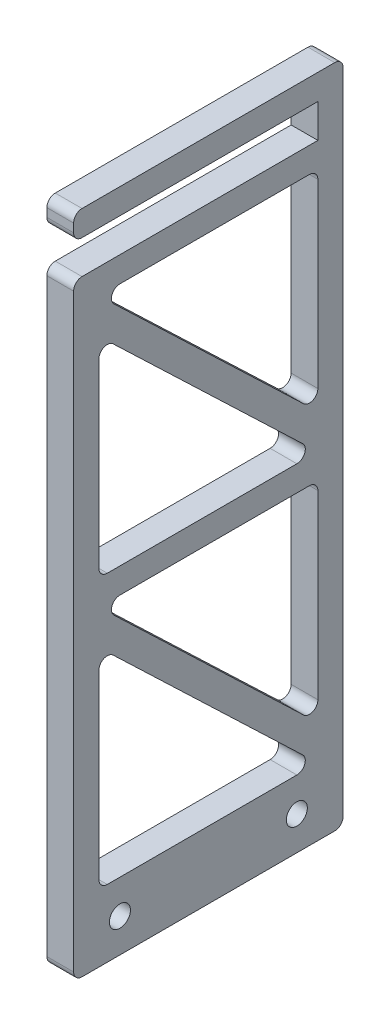
from build123d import *

# Parameters (mm, degrees)
SKETCH1_W             = 32
SKETCH1_H             = 79
BOSS_EXTRUDE1_DEPTH   = 3.175
SKETCH2_W             = 29
SKETCH2_H             = 4
CUT_EXTRUDE1_DEPTH    = 3.175
F_2_5MM_DOWEL_HOLE1_D = 2.5
CUT_EXTRUDE2_DEPTH    = 3.175
FILLET2_R             = 1
FILLET3_R             = 1


with BuildPart() as part:
    # Sketch1 → Boss-Extrude1 (new body)
    with BuildSketch(Plane(origin=(0, 0, 0), x_dir=(0, 0, -1), z_dir=(1, 0, 0))):
        Rectangle(SKETCH1_W, SKETCH1_H)
    extrude(amount=BOSS_EXTRUDE1_DEPTH)

    # Sketch2 → Cut-Extrude1 (cut)
    with BuildSketch(Plane(origin=(3.175, 0, 0), x_dir=(0, 0, -1), z_dir=(1, 0, 0))):
        with Locations((-1.5, 34.5)):
            Rectangle(SKETCH2_W, SKETCH2_H)
    extrude(amount=-CUT_EXTRUDE1_DEPTH, mode=Mode.SUBTRACT)

    # Ø2.5mm Dowel Hole1 (through all)
    with Locations(Plane.ZY):
        with Locations((-10.5, -35.5), (10.5, -35.5)):
            Hole(F_2_5MM_DOWEL_HOLE1_D / 2)

    # Sketch8 → Cut-Extrude2 (cut)
    with BuildSketch(Plane(origin=(3.175, 0, 0), x_dir=(0, 0, -1), z_dir=(1, 0, 0))):
        Polygon((-13, -31.5), (13, -31.5), (-13, -6.649883213), align=None)
        Polygon((-13, -2.5), (13, -27.350116787), (13, -2.5), align=None)
        Polygon((-13, 0.5), (13, 0.5), (-13, 25.350116787), align=None)
        Polygon((-13, 29.5), (13, 4.649883213), (13, 29.5), align=None)
    extrude(amount=-CUT_EXTRUDE2_DEPTH, mode=Mode.SUBTRACT)

    # Fillet2
    fillet2_edges = [part.edges().sort_by_distance(p)[0] for p in [
        (1.5875, 32.5, 16),
        (1.5875, 36.5, 16),
        (1.5875, -39.5, -16),
        (1.5875, -39.5, 16),
        (1.5875, 39.5, 16),
        (1.5875, 39.5, -16),
    ]]
    fillet(fillet2_edges, radius=FILLET2_R)

    # Fillet3
    fillet3_edges = [part.edges().sort_by_distance(p)[0] for p in [
        (1.5875, -2.5, -13),
        (1.5875, -27.350116787, -13),
        (1.5875, -2.5, 13),
        (1.5875, 0.5, 13),
        (1.5875, 25.350116787, 13),
        (1.5875, 0.5, -13),
        (1.5875, 29.5, -13),
        (1.5875, 4.649883213, -13),
        (1.5875, 29.5, 13),
        (1.5875, -31.5, 13),
        (1.5875, -6.649883213, 13),
        (1.5875, -31.5, -13),
    ]]
    fillet(fillet3_edges, radius=FILLET3_R)


solid = part.part
